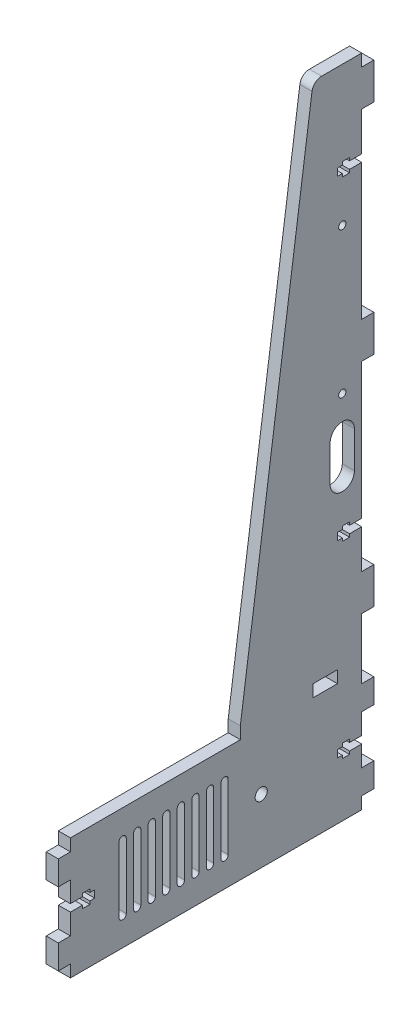
from build123d import *

# Parameters (mm, degrees)
SKETCH1_W           = 10
SKETCH1_H           = 5
BOSS_EXTRUDE1_DEPTH = 5
SKETCH2_W           = 5
SKETCH2_H           = 10
SKETCH2_H_2         = 15
BOSS_EXTRUDE2_DEPTH = 5
SKETCH3_R           = 2.5
SKETCH3_R_2         = 1.5
CUT_EXTRUDE1_DEPTH  = 298.573520327
CUT_EXTRUDE2_DEPTH  = 298.573520327
FILLET1_R           = 4


with BuildPart() as part:
    # Sketch1 → Boss-Extrude1 (new body)
    with BuildSketch(Plane(origin=(0, 0, 0), x_dir=(0, 0, -1), z_dir=(1, 0, 0))):
        Polygon((-50, 50), (-50, 55), (-20, 270), (0, 270), (0, 55), (0, 50), (0, 0), (-120, 0), (-120, 50), align=None)
        with Locations((-15, 52.5)):
            Rectangle(SKETCH1_W, SKETCH1_H, mode=Mode.SUBTRACT)
    extrude(amount=BOSS_EXTRUDE1_DEPTH)

    # Sketch2 → Boss-Extrude2 (add)
    with BuildSketch(Plane(origin=(5, 0, 0), x_dir=(0, 0, -1), z_dir=(1, 0, 0))):
        with Locations((-122.5, 10)):
            Rectangle(SKETCH2_W, SKETCH2_H)
        with Locations((-122.5, 40)):
            Rectangle(SKETCH2_W, SKETCH2_H)
        with Locations((2.5, 257.5)):
            Rectangle(SKETCH2_W, SKETCH2_H_2)
        with Locations((2.5, 77.5)):
            Rectangle(SKETCH2_W, SKETCH2_H_2)
        with Locations((2.5, 40)):
            Rectangle(SKETCH2_W, SKETCH2_H)
        with Locations((2.5, 10)):
            Rectangle(SKETCH2_W, SKETCH2_H)
        with Locations((2.5, 167.5)):
            Rectangle(SKETCH2_W, SKETCH2_H_2)
    extrude(amount=-BOSS_EXTRUDE2_DEPTH)

    # Sketch3 → Cut-Extrude1 (cut, through all)
    with BuildSketch(Plane(origin=(5, 0, 0), x_dir=(0, 0, -1), z_dir=(1, 0, 0))):
        with Locations((-41.4, 26.3)):
            Circle(SKETCH3_R)
        with Locations((-8, 212.5)):
            Circle(SKETCH3_R_2)
        with Locations((-8, 152.5)):
            Circle(SKETCH3_R_2)
        Polygon((0, 26.5), (-5, 26.5), (-5, 27.75), (-8, 27.75), (-8, 26.5), (-10, 26.5), (-10, 23.5), (-8, 23.5), (-8, 22.25), (-5, 22.25), (-5, 23.5), (0, 23.5), align=None)
        Polygon((0, 104), (-5, 104), (-5, 105.25), (-8, 105.25), (-8, 104), (-10, 104), (-10, 101), (-8, 101), (-8, 99.75), (-5, 99.75), (-5, 101), (0, 101), align=None)
        Polygon((0, 234), (-5, 234), (-5, 235.25), (-8, 235.25), (-8, 234), (-10, 234), (-10, 231), (-8, 231), (-8, 229.75), (-5, 229.75), (-5, 231), (0, 231), align=None)
        Polygon((-120, 23.5), (-120, 26.5), (-115, 26.5), (-115, 27.75), (-112, 27.75), (-112, 26.5), (-110, 26.5), (-110, 23.5), (-112, 23.5), (-112, 22.25), (-115, 22.25), (-115, 23.5), align=None)
        with BuildLine():
            Line((-3, 137.5), (-3, 122.5))
            ThreePointArc((-3, 122.5), (-8, 117.5), (-13, 122.5))
            Line((-13, 122.5), (-13, 137.5))
            ThreePointArc((-13, 137.5), (-8, 142.5), (-3, 137.5))
        make_face()
    extrude(amount=-CUT_EXTRUDE1_DEPTH, mode=Mode.SUBTRACT)

    # Sketch4 → Cut-Extrude2 (cut, through all)
    with BuildSketch(Plane(origin=(5, 0, 0), x_dir=(0, 0, -1), z_dir=(1, 0, 0))):
        with BuildLine():
            Line((-97, 38.5), (-97, 11.5))
            ThreePointArc((-97, 11.5), (-98.5, 10), (-100, 11.5))
            Line((-100, 11.5), (-100, 38.5))
            ThreePointArc((-100, 38.5), (-98.5, 40), (-97, 38.5))
        make_face()
        with BuildLine():
            Line((-91, 38.5), (-91, 11.5))
            ThreePointArc((-91, 11.5), (-92.5, 10), (-94, 11.5))
            Line((-94, 11.5), (-94, 38.5))
            ThreePointArc((-94, 38.5), (-92.5, 40), (-91, 38.5))
        make_face()
        with BuildLine():
            Line((-85, 38.5), (-85, 11.5))
            ThreePointArc((-85, 11.5), (-86.5, 10), (-88, 11.5))
            Line((-88, 11.5), (-88, 38.5))
            ThreePointArc((-88, 38.5), (-86.5, 40), (-85, 38.5))
        make_face()
        with BuildLine():
            Line((-79, 38.5), (-79, 11.5))
            ThreePointArc((-79, 11.5), (-80.5, 10), (-82, 11.5))
            Line((-82, 11.5), (-82, 38.5))
            ThreePointArc((-82, 38.5), (-80.5, 40), (-79, 38.5))
        make_face()
        with BuildLine():
            Line((-73, 38.5), (-73, 11.5))
            ThreePointArc((-73, 11.5), (-74.5, 10), (-76, 11.5))
            Line((-76, 11.5), (-76, 38.5))
            ThreePointArc((-76, 38.5), (-74.5, 40), (-73, 38.5))
        make_face()
        with BuildLine():
            Line((-67, 38.5), (-67, 11.5))
            ThreePointArc((-67, 11.5), (-68.5, 10), (-70, 11.5))
            Line((-70, 11.5), (-70, 38.5))
            ThreePointArc((-70, 38.5), (-68.5, 40), (-67, 38.5))
        make_face()
        with BuildLine():
            Line((-61, 38.5), (-61, 11.5))
            ThreePointArc((-61, 11.5), (-62.5, 10), (-64, 11.5))
            Line((-64, 11.5), (-64, 38.5))
            ThreePointArc((-64, 38.5), (-62.5, 40), (-61, 38.5))
        make_face()
        with BuildLine():
            Line((-55, 38.5), (-55, 11.5))
            ThreePointArc((-55, 11.5), (-56.5, 10), (-58, 11.5))
            Line((-58, 11.5), (-58, 38.5))
            ThreePointArc((-58, 38.5), (-56.5, 40), (-55, 38.5))
        make_face()
    extrude(amount=-CUT_EXTRUDE2_DEPTH, mode=Mode.SUBTRACT)

    # Fillet1
    fillet1_edges = [part.edges().sort_by_distance(p)[0] for p in [
        (2.5, 270, 20),
    ]]
    fillet(fillet1_edges, radius=FILLET1_R)


solid = part.part
